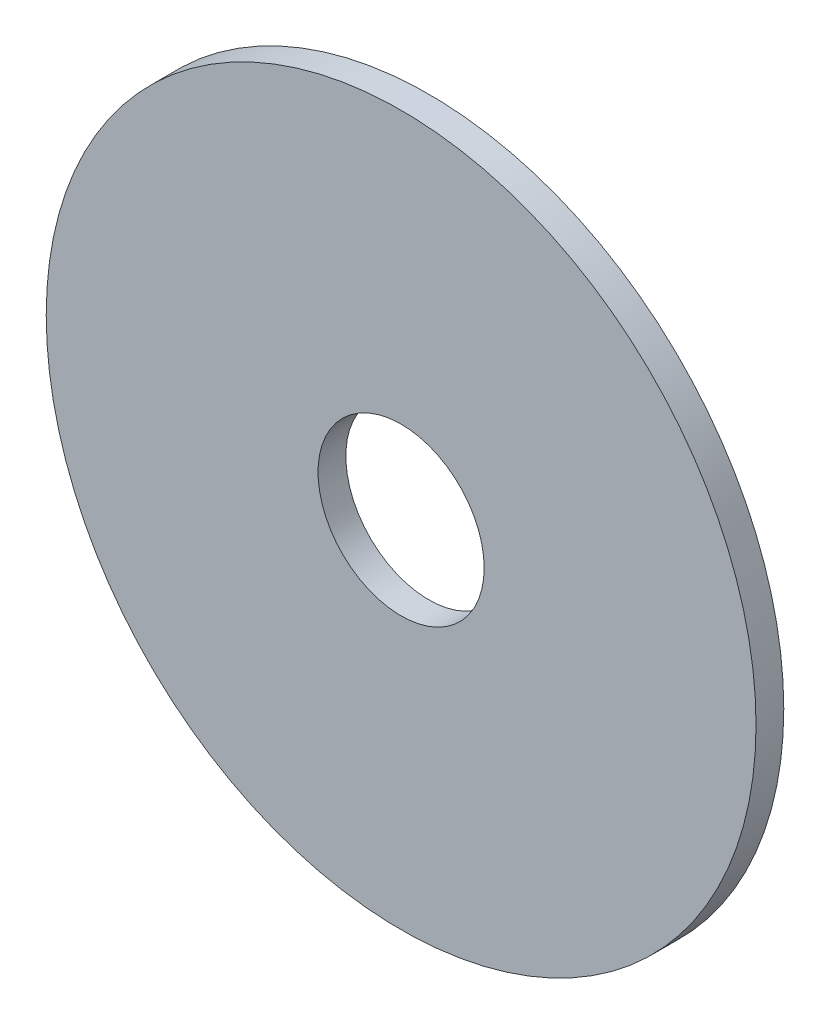
from build123d import *

# Parameters (mm, degrees)
SKETCH1_R           = 76.73
BOSS_EXTRUDE1_DEPTH = 6
SKETCH2_R           = 17.9565
CUT_EXTRUDE1_DEPTH  = 6


with BuildPart() as part:
    # Sketch1 → Boss-Extrude1 (new body)
    with BuildSketch(Plane.XY):
        Circle(SKETCH1_R)
    extrude(amount=BOSS_EXTRUDE1_DEPTH)

    # Sketch2 → Cut-Extrude1 (cut)
    with BuildSketch(Plane.XY.offset(6)):
        Circle(SKETCH2_R)
    extrude(amount=-CUT_EXTRUDE1_DEPTH, mode=Mode.SUBTRACT)


solid = part.part
